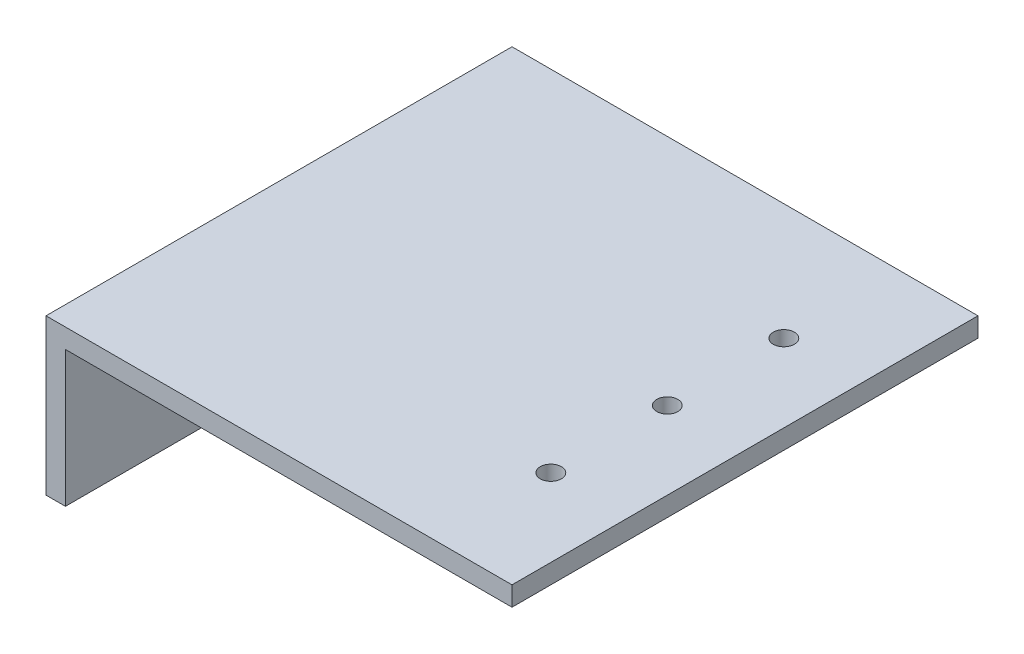
from build123d import *

# Parameters (mm, degrees)
BOSS_EXTRUDE1_DEPTH       = 76.2
CUT_EXTRUDE1_REACH        = 112.716
SKETCH8_R                 = 3.175
TAP_DRILL_FOR_8_32_TAP1_D = 3.4544
TAP_DRILL_FOR_8_32_TAP2_D = 3.4544


with BuildPart() as part:
    # Sketch2 → Boss-Extrude1 (new body)
    with BuildSketch(Plane.XY):
        Polygon((0, 0), (-76.2, 0), (-76.2, -25.4), (-73.025, -25.4), (-73.025, -3.175), (0, -3.175), align=None)
    extrude(amount=BOSS_EXTRUDE1_DEPTH)

    # Sketch8 → Cut-Extrude1 (cut, up to next)
    with BuildSketch(Plane.ZY.offset(76.2), mode=Mode.PRIVATE) as cut_extrude1_sk1:
        with Locations((38.1, -15.24)):
            Circle(SKETCH8_R)
    cut_extrude1_tool1 = extrude(cut_extrude1_sk1.sketch, amount=-CUT_EXTRUDE1_REACH, mode=Mode.PRIVATE) & part.part
    add(cut_extrude1_tool1.solids().sort_by_distance((-76.2, -15.24, 38.1))[0], mode=Mode.SUBTRACT)

    # Tap Drill for #8-32 Tap1 (through all)
    with Locations(Plane(origin=(0, 0, 0), x_dir=(1, 0, 0), z_dir=(0, 1, 0))):
        with Locations((-12.7, -38.1), (-12.7, -19.05), (-12.7, -57.15)):
            Hole(TAP_DRILL_FOR_8_32_TAP1_D / 2)

    # Tap Drill for #8-32 Tap2 (through all)
    with Locations(Plane.ZY.offset(76.2)):
        with Locations((25.4, -15.24), (50.8, -15.24)):
            Hole(TAP_DRILL_FOR_8_32_TAP2_D / 2)


solid = part.part
